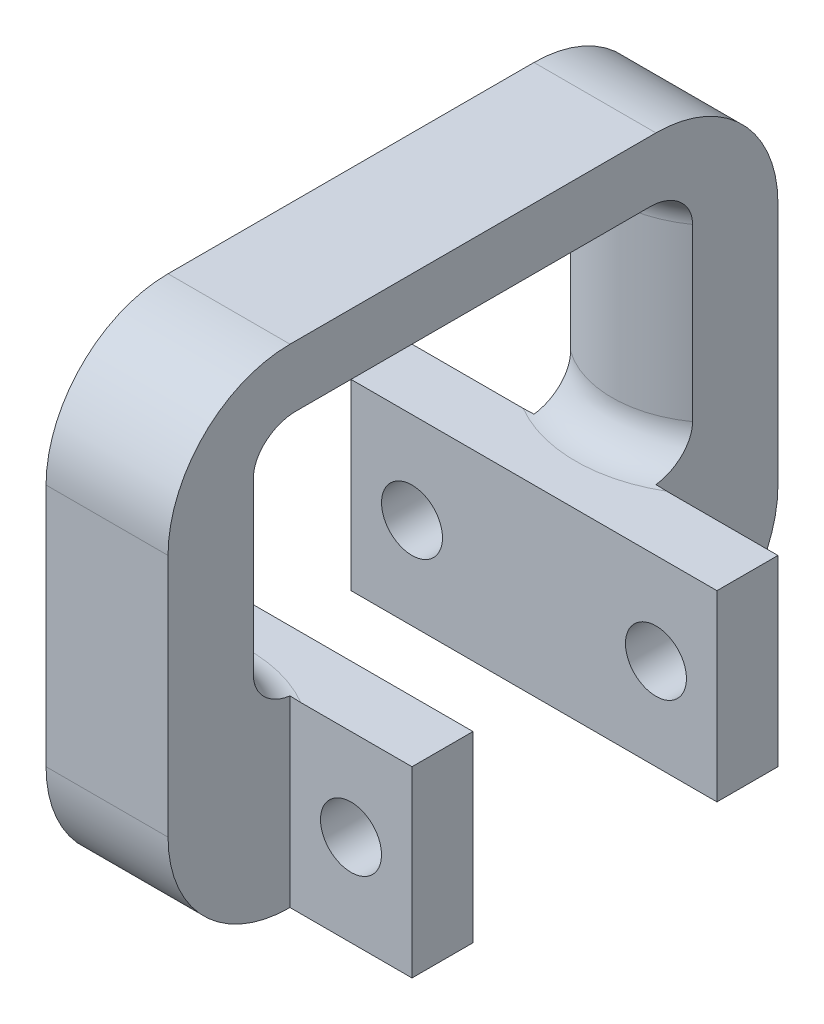
from build123d import *

# Parameters (mm, degrees)
ESQUISSE1_W        = 30
ESQUISSE1_H        = 15
ESQUISSE1_R        = 2.5
BOSS_EXTRU_2_DEPTH = 5
ESQUISSE2_W        = 10
ESQUISSE2_H        = 15
BOSS_EXTRU_3_DEPTH = 10
ESQUISSE3_W        = 10
ESQUISSE3_H        = 7
BOSS_EXTRU_5_DEPTH = 25
BOSS_EXTRU_6_DEPTH = 20
ESQUISSE4_W        = 10
ESQUISSE4_H        = 5
BOSS_EXTRU_7_DEPTH = 18
CONG_1_R           = 10
CONG_2_R           = 3


with BuildPart() as part:
    # Esquisse1 → Boss.-Extru.2 (new body)
    with BuildSketch(Plane.XY):
        Rectangle(ESQUISSE1_W, ESQUISSE1_H)
        with Locations((-10, 0)):
            Circle(ESQUISSE1_R, mode=Mode.SUBTRACT)
        with Locations((10, 0)):
            Circle(ESQUISSE1_R, mode=Mode.SUBTRACT)
    extrude(amount=BOSS_EXTRU_2_DEPTH)

    # Esquisse2 → Boss.-Extru.3 (add)
    with BuildSketch(Plane.XY.offset(5)):
        Rectangle(ESQUISSE2_W, ESQUISSE2_H)
    extrude(amount=BOSS_EXTRU_3_DEPTH)

    # Esquisse3 → Boss.-Extru.5 (add)
    with BuildSketch(Plane(origin=(0, 7.5, 0), x_dir=(1, 0, 0), z_dir=(0, 1, 0))):
        with Locations((0, -11.5)):
            Rectangle(ESQUISSE3_W, ESQUISSE3_H)
    extrude(amount=BOSS_EXTRU_5_DEPTH)

    # Esquisse3<4> → Boss.-Extru.6 (add)
    with BuildSketch(Plane(origin=(0, 7.5, 0), x_dir=(1, 0, 0), z_dir=(0, 1, 0))):
        with BuildLine():
            ThreePointArc((5, -8), (0, -6.397674733), (-5, -8))
            Line((-5, -8), (5, -8))
        make_face()
    extrude(amount=BOSS_EXTRU_6_DEPTH)

    # Esquisse4 → Boss.-Extru.7 (add)
    with BuildSketch(Plane(origin=(0, 0, 8), x_dir=(-1, 0, 0), z_dir=(0, 0, -1))):
        with Locations((0, 30)):
            Rectangle(ESQUISSE4_W, ESQUISSE4_H)
    extrude(amount=BOSS_EXTRU_7_DEPTH)

    # Congé1
    cong_1_edges = [part.edges().sort_by_distance(p)[0] for p in [
        (0, -7.5, 15),
        (0, 32.5, 15),
    ]]
    fillet(cong_1_edges, radius=CONG_1_R)

    # Congé2
    cong_2_edges = [part.edges().sort_by_distance(p)[0] for p in [
        (0, 7.5, 6.397674733),
        (0, 27.5, 6.397674733),
    ]]
    fillet(cong_2_edges, radius=CONG_2_R)

    # Symétrie3: part across plane


with BuildPart() as part_1:
    add(part.part)
    add(part.part.mirror(Plane(origin=(0, 0, -10), x_dir=(1, 0, 0), z_dir=(0, 0, -1))))


solid = part_1.part
